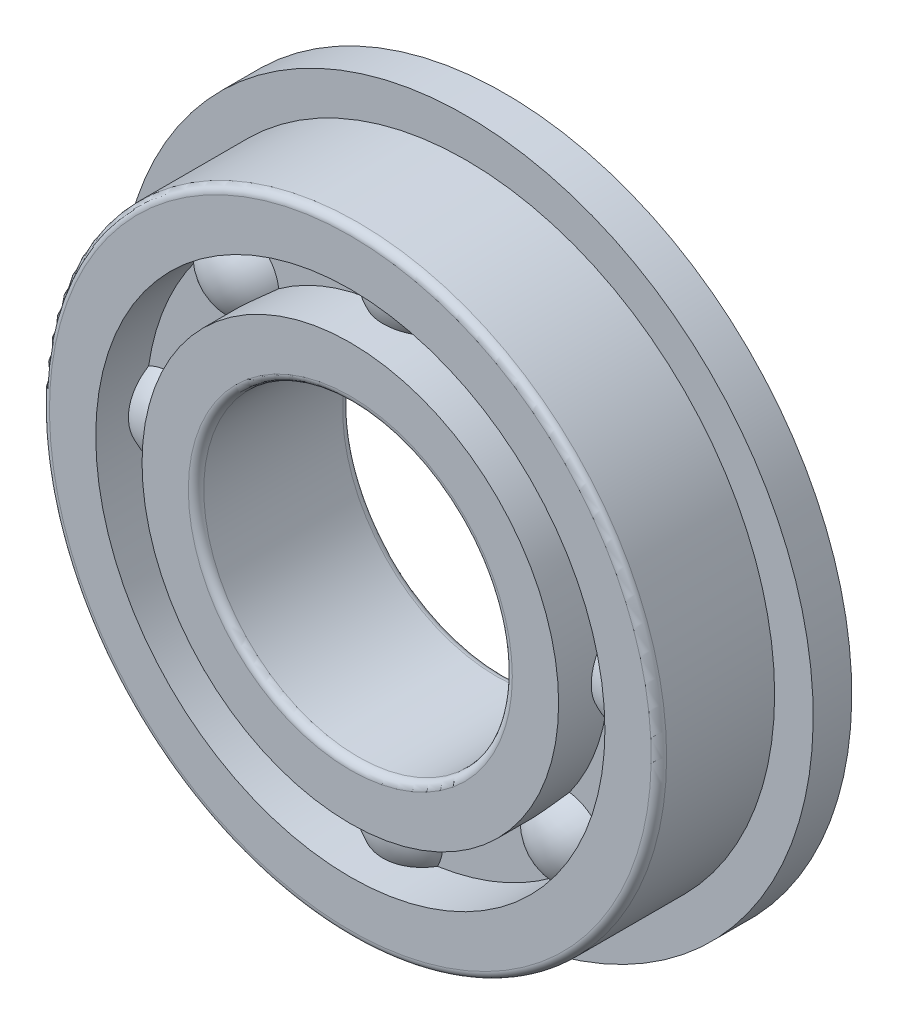
from build123d import *

# Parameters (mm, degrees)
CIRPATTERN1_COUNT = 8
FILLET1_R         = 0.2


with BuildPart() as part:
    # Sketch2 → Base-Revolve (revolve)
    with BuildSketch(Plane(origin=(0, 0, 0), x_dir=(0, 0, -1), z_dir=(1, 0, 0)), mode=Mode.PRIVATE) as base_revolve_sk:
        Polygon((0.7, 5.4), (2, 5.4), (2, 4), (-2, 4), (-2, 5.4), (-0.7, 5.4), (-0.7, 6.6), (-2, 6.6), (-2, 8), (1, 8), (1, 9), (2, 9), (2, 6.6), (0.7, 6.6), align=None)
    revolve(base_revolve_sk.sketch.rotate(Axis((0, 0, 2), (0, 0, -1)), 180), axis=Axis((0, 0, 2), (0, 0, -1)))

    # Sketch4 → Boss-Revolve1 (revolve)
    with BuildSketch(Plane(origin=(0, 0, 0), x_dir=(0, 0, -1), z_dir=(1, 0, 0))):
        with BuildLine():
            Line((0, 7.3), (0, 4.7))
            ThreePointArc((0, 4.7), (1.3, 6), (0, 7.3))
        make_face()
    boss_revolve1 = revolve(axis=Axis((0, 4.7, 0), (0, -1, 0)))

    # Sketch5 → Cut-Revolve1 (revolve, cut)
    with BuildSketch(Plane(origin=(0, 0, 0), x_dir=(0, 0, -1), z_dir=(1, 0, 0))):
        with BuildLine():
            Line((0, 7.29), (0, 4.71))
            ThreePointArc((0, 4.71), (1.29, 6), (0, 7.29))
        make_face()
    cut_revolve1 = revolve(axis=Axis((0, 4.71, 0), (0, -1, 0)), mode=Mode.SUBTRACT)

    # CirPattern1: Boss-Revolve1, Cut-Revolve1 ×8 about axis
    cirpattern1_axis = Axis((0, 0, 0), (0, 0, 1))
    add([boss_revolve1.rotate(cirpattern1_axis, i * 360 / CIRPATTERN1_COUNT) for i in range(1, CIRPATTERN1_COUNT)])
    add([cut_revolve1.rotate(cirpattern1_axis, i * 360 / CIRPATTERN1_COUNT) for i in range(1, CIRPATTERN1_COUNT)], mode=Mode.SUBTRACT)

    # Fillet1
    fillet1_edges = [part.edges().sort_by_distance(p)[0] for p in [
        (0, 4, -2),
        (0, 4, 2),
        (0, 8, 2),
    ]]
    fillet(fillet1_edges, radius=FILLET1_R)


solid = part.part
